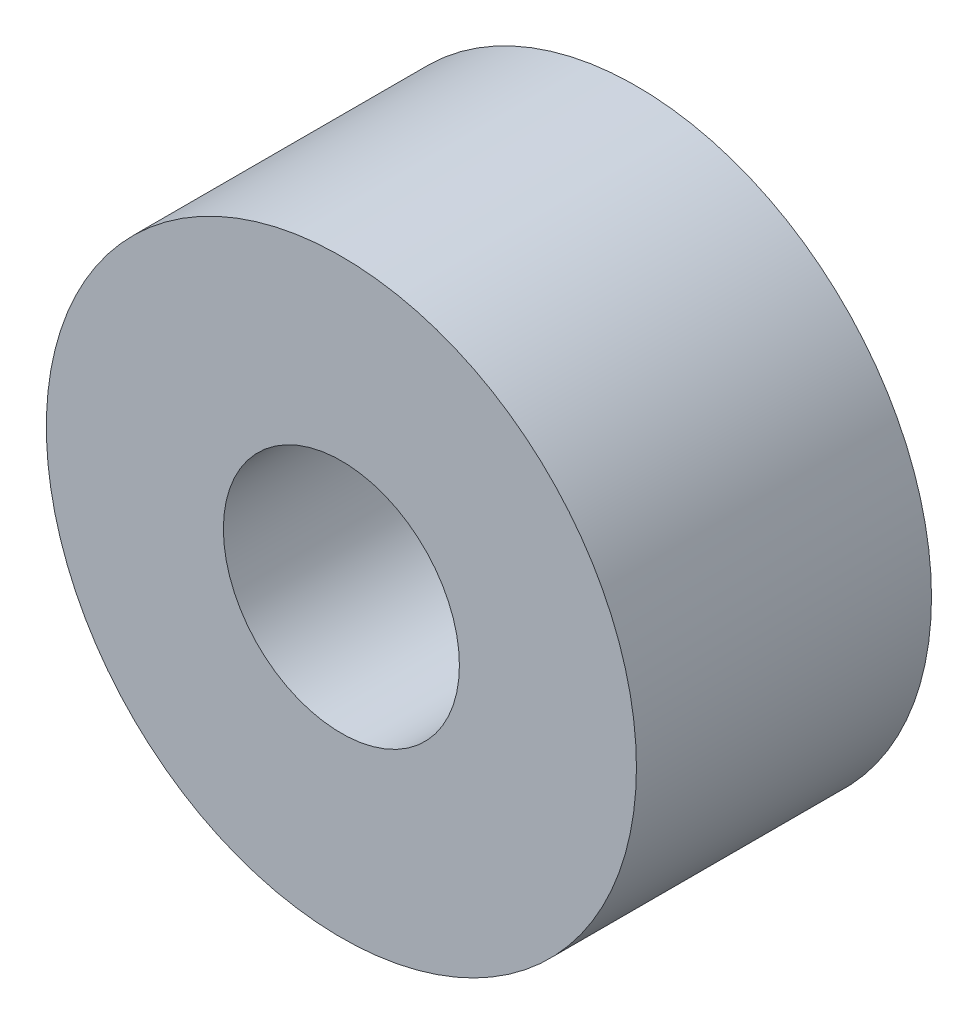
from build123d import *

# Parameters (mm, degrees)
SKETCH_1_R      = 2.5
SKETCH_1_R_2    = 1
EXTRUDE_1_DEPTH = 1.25


with BuildPart() as part:
    # 草图1 → 凸台-拉伸1 (new, symmetric)
    with BuildSketch(Plane.XY):
        Circle(SKETCH_1_R)
        Circle(SKETCH_1_R_2, mode=Mode.SUBTRACT)
    extrude(amount=EXTRUDE_1_DEPTH, both=True)


solid = part.part
